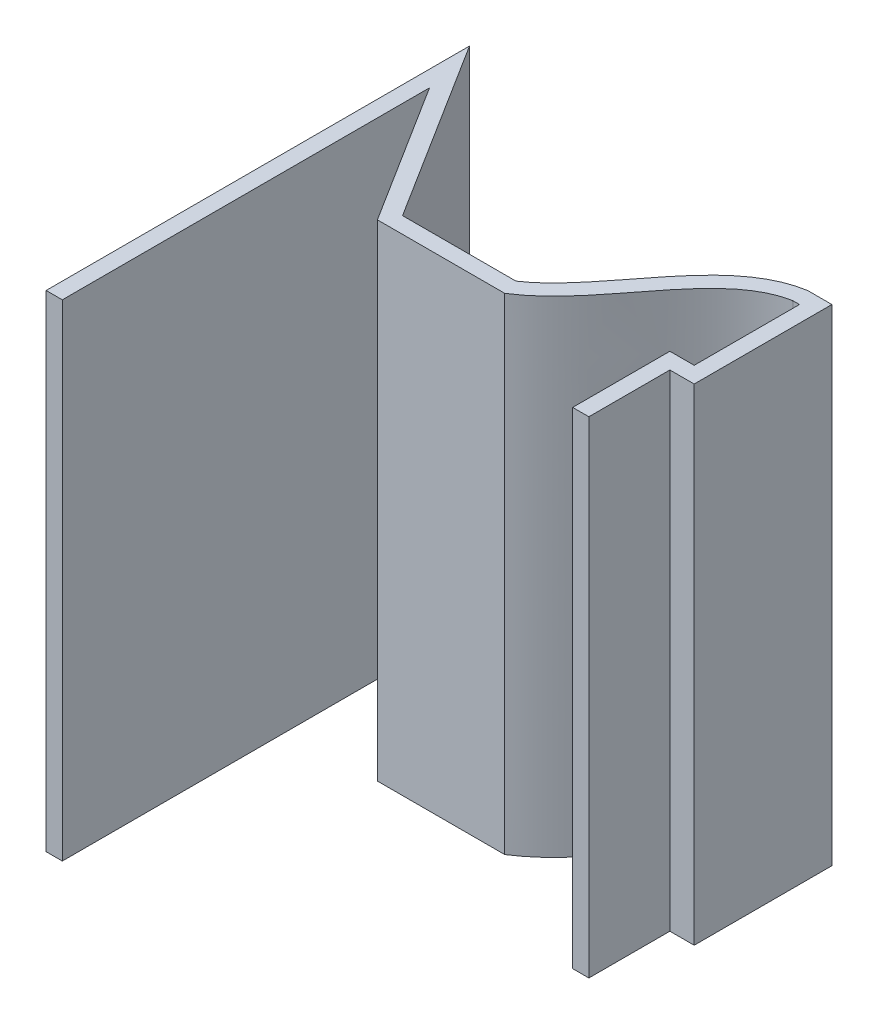
from build123d import *

# Parameters (mm, degrees)
BOSS_EXTRUDE12_DEPTH = 60
BOSS_EXTRUDE13_DEPTH = 8
SKETCH3_W            = 20
SKETCH3_H            = 60
CUT_EXTRUDE1_DEPTH   = 10


with BuildPart() as part:
    # Sketch1 → Boss-Extrude12 (new body)
    with BuildSketch(Plane(origin=(0, 0, 0), x_dir=(1, 0, 0), z_dir=(0, 1, 0))):
        with BuildLine():
            Line((3, 47), (3, 30))
            Line((3, 30), (0, 30))
            Line((0, 30), (0, 0))
            Line((0, 0), (-2, 0))
            Line((-2, 0), (-2, 32))
            Line((-2, 32), (1, 32))
            Line((1, 32), (1, 45))
            Line((1, 45), (0.176102142, 45))
            add(Edge.make_bspline(
                [(-18.386432119, 28), (-18.281589374, 28.071011485), (-18.076006872, 28.210643772), (-17.632017964, 28.509033814), (-16.788752159, 29.127765228), (-15.266101597, 30.436706514), (-13.281769764, 32.578807621), (-11.116323446, 35.322397153), (-8.327983452, 38.971629637), (-4.796332276, 42.989291988), (-1.605396872, 44.667429051), (0.176102142, 45)],
                knots=[0.007315744, 0.007315744, 0.007315744, 0.007315744, 0.023228008, 0.039140272, 0.0709648, 0.134613856, 0.261911967, 0.389210078, 0.516508189, 0.771104411, 1.025700634, 1.025700634, 1.025700634, 1.025700634], degree=3))
            Line((-18.386432119, 28), (-34.105031298, 28))
            Line((-34.105031298, 28), (-45, 45.32952773))
            Line((-45, 45.32952773), (-45, 0))
            Line((-45, 0), (-47, 0))
            Line((-47, 0), (-47, 52.268387809))
            Line((-47, 52.268387809), (-33, 30))
            Line((-33, 30), (-19, 30))
            add(Edge.make_bspline(
                [(0, 47), (-8.735842334, 45.522262704), (-12.411198706, 34.462689008), (-19, 30)],
                knots=[0, 0, 0, 0, 1, 1, 1, 1], degree=3))
            Line((0, 47), (3, 47))
        make_face()
    extrude(amount=BOSS_EXTRUDE12_DEPTH)

    # Sketch2 → Boss-Extrude13 (add)
    with BuildSketch(Plane(origin=(0, 0, -30), x_dir=(-1, 0, 0), z_dir=(0, 0, -1))):
        with BuildLine():
            Line((33, 0), (19, 0))
            Line((19, 0), (19, 2.423963318))
            ThreePointArc((19, 2.423963318), (26, 2), (33, 2.423963318))
            Line((33, 2.423963318), (33, 0))
        make_face()
    extrude(amount=BOSS_EXTRUDE13_DEPTH)

    # Sketch3 → Cut-Extrude1 (cut)
    with BuildSketch(Plane(origin=(0, 0, 0), x_dir=(0, 0, -1), z_dir=(1, 0, 0))):
        with Locations((10, 30)):
            Rectangle(SKETCH3_W, SKETCH3_H)
    extrude(amount=-CUT_EXTRUDE1_DEPTH, mode=Mode.SUBTRACT)


solid = part.part
